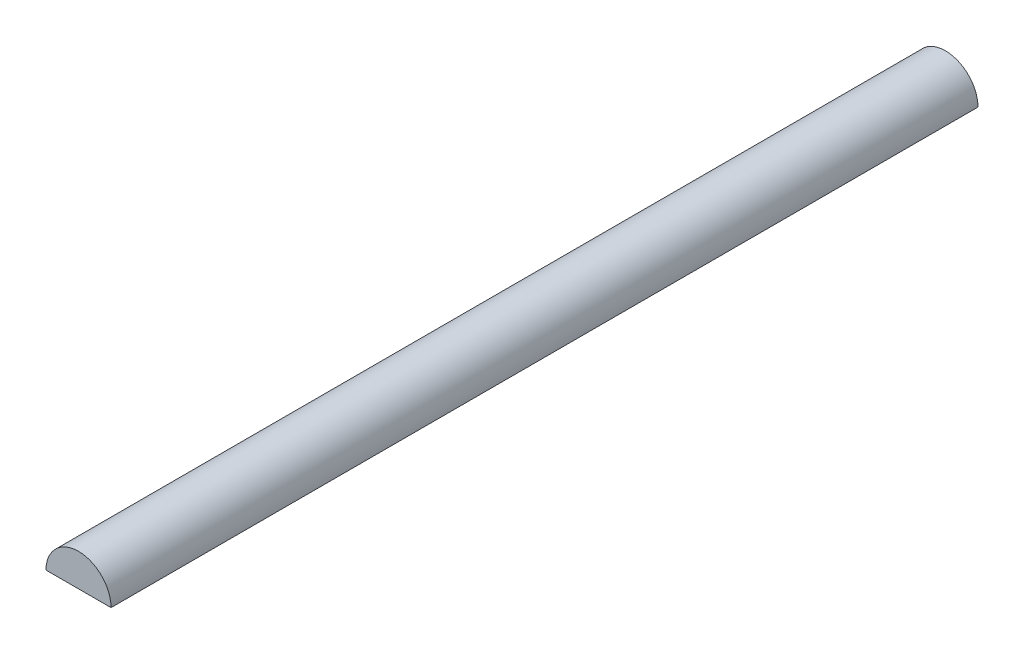
from build123d import *

# Parameters (mm, degrees)
SKETCH1_R           = 0.75
BOSS_EXTRUDE1_DEPTH = 20
SKETCH2_W           = 13.825579046
SKETCH2_H           = 29.41502706
CUT_EXTRUDE1_DEPTH  = 20


with BuildPart() as part:
    # Sketch1 → Boss-Extrude1 (new body)
    with BuildSketch(Plane.XY):
        Circle(SKETCH1_R)
    extrude(amount=BOSS_EXTRUDE1_DEPTH)

    # Sketch2 → Cut-Extrude1 (cut)
    with BuildSketch(Plane(origin=(0, 0, 0), x_dir=(1, 0, 0), z_dir=(0, 1, 0))):
        with Locations((0, -9.700113021)):
            Rectangle(SKETCH2_W, SKETCH2_H)
    extrude(amount=-CUT_EXTRUDE1_DEPTH, mode=Mode.SUBTRACT)


solid = part.part
